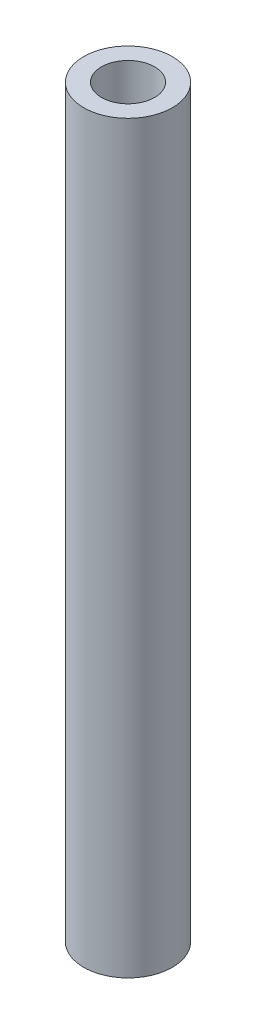
from build123d import *

# Parameters (mm, degrees)
SKETCH_1_R      = 2.5
SKETCH_1_R_2    = 1.5
EXTRUDE_1_DEPTH = 42


with BuildPart() as part:
    # 草图1 → 凸台-拉伸1 (new body)
    with BuildSketch(Plane(origin=(0, 0, 0), x_dir=(1, 0, 0), z_dir=(0, 1, 0))):
        with Locations(Location((0, 0, 0), (0, 0, 90))):
            Circle(SKETCH_1_R)
        with Locations(Location((0, 0, 0), (0, 0, 90))):
            Circle(SKETCH_1_R_2, mode=Mode.SUBTRACT)
    extrude(amount=EXTRUDE_1_DEPTH)


solid = part.part
